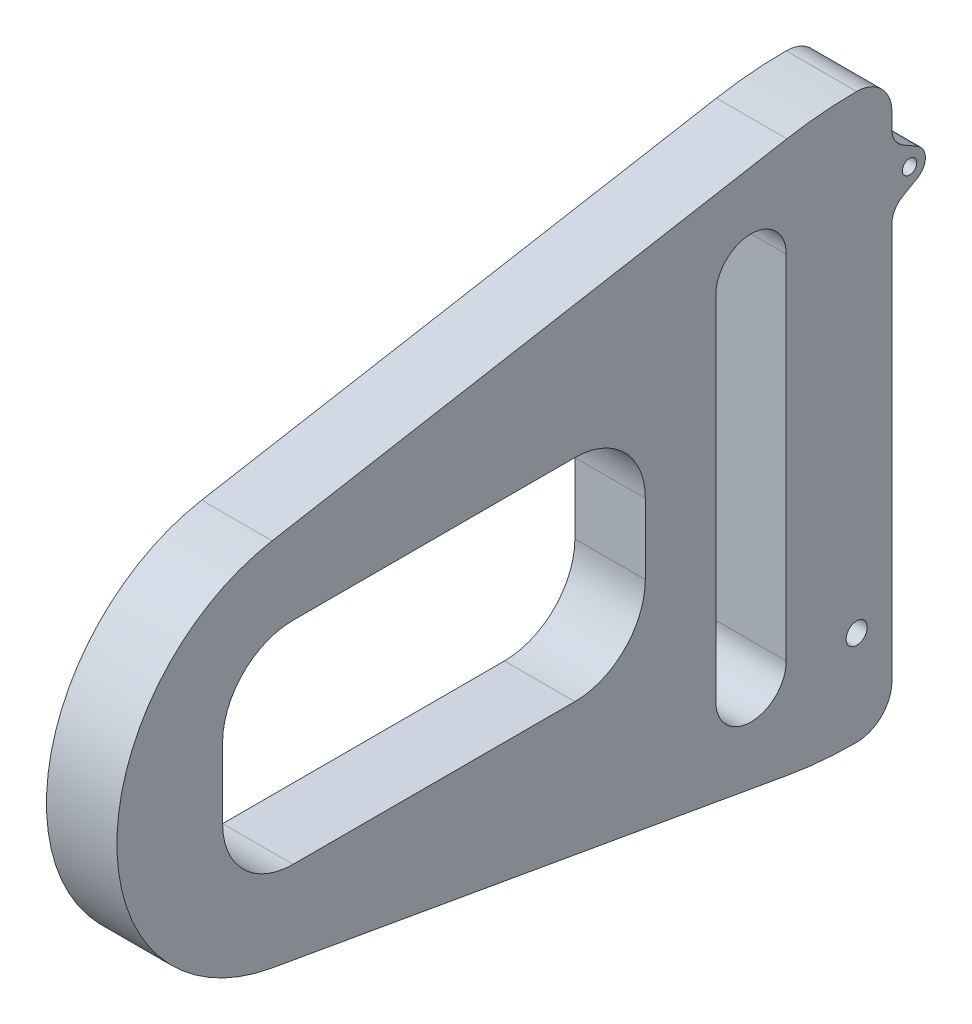
from build123d import *

# Parameters (mm, degrees)
ESQUISSE1_W             = 10
ESQUISSE1_H             = 80
BOSS_EXTRU_1_DEPTH      = 10
BOSS_EXTRU_2_DEPTH      = 10
CONG_1_R                = 26.656312
ESQUISSE4_R             = 1.5
ENL_V_MAT_EXTRU_2_DEPTH = 118.473401245
ESQUISSE7_R             = 1.025
BOSS_EXTRU_3_DEPTH      = 10
CONG_2_R                = 3
CONG_3_R                = 3
CONG_4_R                = 5
CONG_5_R                = 57
CONG_6_R                = 57


with BuildPart() as part:
    # Esquisse1 → Boss.-Extru.1 (new body)
    with BuildSketch(Plane.XY):
        Rectangle(ESQUISSE1_W, ESQUISSE1_H)
    extrude(amount=BOSS_EXTRU_1_DEPTH)

    # Esquisse2 → Boss.-Extru.2 (add, through all)
    with BuildSketch(Plane.ZY.offset(5)):
        Polygon((10, 40), (110, 22.367301929), (110, -22.367301929), (10, -40), align=None)
        with BuildLine():
            Line((25, 25), (25, -25))
            ThreePointArc((25, -25), (20, -30), (15, -25))
            Line((15, -25), (15, 25))
            ThreePointArc((15, 25), (20, 30), (25, 25))
        make_face(mode=Mode.SUBTRACT)
        with BuildLine():
            Line((45, 15), (85, 15))
            ThreePointArc((85, 15), (92.071067812, 12.071067812), (95, 5))
            Line((95, 5), (95, -5))
            ThreePointArc((95, -5), (92.071067812, -12.071067812), (85, -15))
            Line((85, -15), (45, -15))
            ThreePointArc((45, -15), (37.928932188, -12.071067812), (35, -5))
            Line((35, -5), (35, 5))
            ThreePointArc((35, 5), (37.928932188, 12.071067812), (45, 15))
        make_face(mode=Mode.SUBTRACT)
    extrude(amount=-BOSS_EXTRU_2_DEPTH)

    # Congé1
    cong_1_edges = [part.edges().sort_by_distance(p)[0] for p in [
        (0, 22.367301929, 110),
        (0, -22.367301929, 110),
    ]]
    fillet(cong_1_edges, radius=CONG_1_R)

    # Esquisse4 → Enlèv. mat.-Extru.2 (cut, through all)
    with BuildSketch(Plane(origin=(5, 0, 0), x_dir=(0, 0, -1), z_dir=(1, 0, 0))):
        with Locations(Location((-5, -26.578661355, 0), (0, 0, 90))):
            Circle(ESQUISSE4_R)
    extrude(amount=-ENL_V_MAT_EXTRU_2_DEPTH, mode=Mode.SUBTRACT)

    # Esquisse7 → Boss.-Extru.3 (add, through all)
    with BuildSketch(Plane(origin=(5, 0, 0), x_dir=(0, 0, -1), z_dir=(1, 0, 0))):
        with BuildLine():
            Line((3.625, 28.948557159), (0, 31.041451884))
            Line((0, 31.041451884), (0, 22.958548116))
            Line((0, 22.958548116), (3.625, 25.051442841))
            ThreePointArc((3.625, 25.051442841), (4.75, 27), (3.625, 28.948557159))
        make_face()
        with Locations(Location((2.5, 27, 0), (0, 0, 90))):
            Circle(ESQUISSE7_R, mode=Mode.SUBTRACT)
    extrude(amount=-BOSS_EXTRU_3_DEPTH)

    # Congé2
    cong_2_edges = [part.edges().sort_by_distance(p)[0] for p in [
        (0, 22.958548116, 0),
    ]]
    fillet(cong_2_edges, radius=CONG_2_R)

    # Congé3
    cong_3_edges = [part.edges().sort_by_distance(p)[0] for p in [
        (0, 31.041451884, 0),
    ]]
    fillet(cong_3_edges, radius=CONG_3_R)

    # Congé4
    cong_4_edges = [part.edges().sort_by_distance(p)[0] for p in [
        (0, -40, 0),
        (0, 40, 0),
    ]]
    fillet(cong_4_edges, radius=CONG_4_R)

    # Congé5
    cong_5_edges = [part.edges().sort_by_distance(p)[0] for p in [
        (0, 40, 10),
    ]]
    fillet(cong_5_edges, radius=CONG_5_R)

    # Congé6
    cong_6_edges = [part.edges().sort_by_distance(p)[0] for p in [
        (0, -40, 10),
    ]]
    fillet(cong_6_edges, radius=CONG_6_R)


solid = part.part
